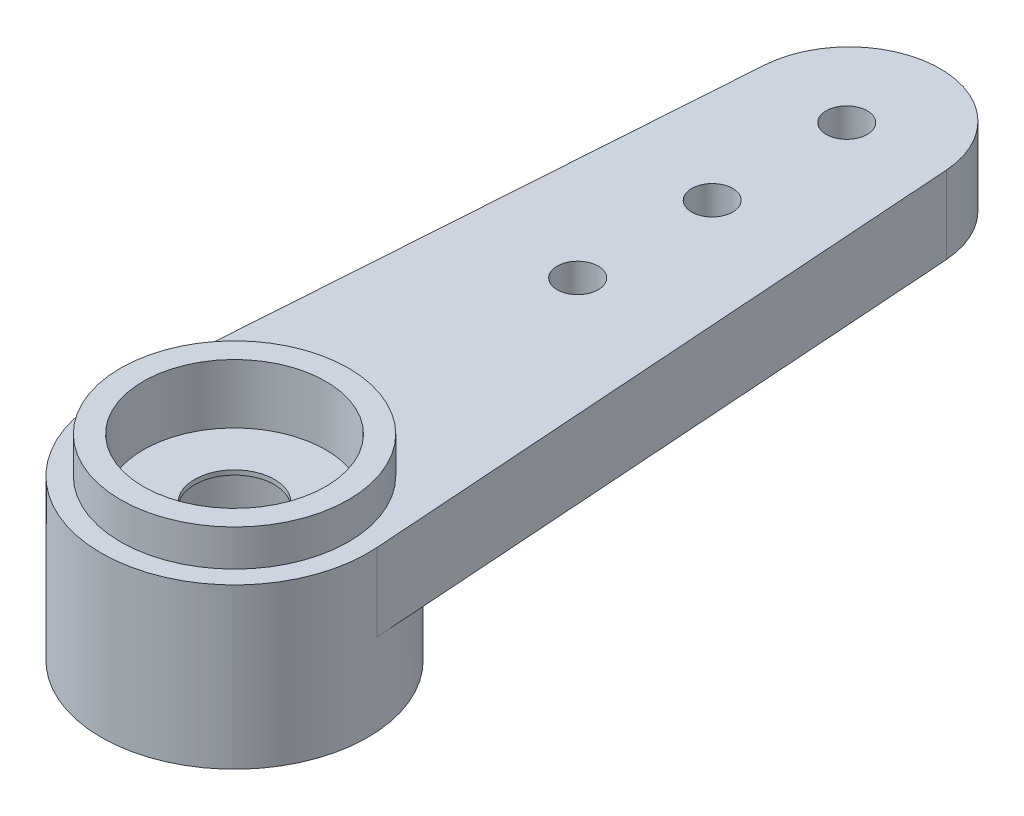
from build123d import *

# Parameters (mm, degrees)
SKETCH1_R           = 2.925
SKETCH1_R_2         = 1.925
BOSS_EXTRUDE1_DEPTH = 1.8
BOSS_EXTRUDE2_DEPTH = 1.7
SKETCH4_R           = 2.5
SKETCH4_R_2         = 2
BOSS_EXTRUDE3_DEPTH = 0.8
SKETCH5_R           = 0.45
CUT_EXTRUDE1_DEPTH  = 17.133234332
SKETCH6_R           = 0.875
CUT_EXTRUDE2_DEPTH  = 17.133234332
SKETCH7_R           = 1.925
CUT_EXTRUDE3_DEPTH  = 1.1
CUT_EXTRUDE4_START  = -0.5
SKETCH8_R           = 2
CUT_EXTRUDE4_DEPTH  = 0.5


with BuildPart() as part:
    # Sketch1 → Boss-Extrude1 (new body)
    with BuildSketch(Plane(origin=(0, 0, 0), x_dir=(1, 0, 0), z_dir=(0, 1, 0))):
        with Locations(Location((0, 0, 0), (0, 0, 270))):
            Circle(SKETCH1_R)
        with Locations(Location((0, 0, 0), (0, 0, 270))):
            Circle(SKETCH1_R_2, mode=Mode.SUBTRACT)
    extrude(amount=BOSS_EXTRUDE1_DEPTH)

    # Sketch3 → Boss-Extrude2 (add)
    with BuildSketch(Plane(origin=(0, 1.8, 0), x_dir=(1, 0, 0), z_dir=(0, 1, 0))):
        with BuildLine():
            Line((2.918100235, 0.200788497), (1.995282212, 13.61229128))
            ThreePointArc((1.995282212, 13.61229128), (0, 15.475), (-1.995282212, 13.61229128))
            Line((-1.995282212, 13.61229128), (-2.918100235, 0.200788497))
            ThreePointArc((-2.918100235, 0.200788497), (0, -2.925), (2.918100235, 0.200788497))
        make_face()
    extrude(amount=BOSS_EXTRUDE2_DEPTH)

    # Sketch4 → Boss-Extrude3 (add)
    with BuildSketch(Plane(origin=(0, 3.5, 0), x_dir=(1, 0, 0), z_dir=(0, 1, 0))):
        with Locations(Location((0, 0, 0), (0, 0, 270))):
            Circle(SKETCH4_R)
        with Locations(Location((0, 0, 0), (0, 0, 270))):
            Circle(SKETCH4_R_2, mode=Mode.SUBTRACT)
    extrude(amount=BOSS_EXTRUDE3_DEPTH)

    # Sketch5 → Cut-Extrude1 (cut, through all)
    with BuildSketch(Plane(origin=(0, 3.5, 0), x_dir=(1, 0, 0), z_dir=(0, 1, 0))):
        with Locations(Location((0, 13.425, 0), (0, 0, 270))):
            Circle(SKETCH5_R)
        with Locations(Location((0, 10.475, 0), (0, 0, 270))):
            Circle(SKETCH5_R)
        with Locations(Location((0, 7.525, 0), (0, 0, 270))):
            Circle(SKETCH5_R)
    extrude(amount=-CUT_EXTRUDE1_DEPTH, mode=Mode.SUBTRACT)

    # Sketch6 → Cut-Extrude2 (cut, through all)
    with BuildSketch(Plane(origin=(0, 3.5, 0), x_dir=(1, 0, 0), z_dir=(0, 1, 0))):
        with Locations(Location((0, 0, 0), (0, 0, 270))):
            Circle(SKETCH6_R)
    extrude(amount=-CUT_EXTRUDE2_DEPTH, mode=Mode.SUBTRACT)

    # Sketch7 → Cut-Extrude3 (cut)
    with BuildSketch(Plane.XZ.offset(-1.8)):
        with Locations(Location((0, 0, 0), (0, 0, 270))):
            Circle(SKETCH7_R)
    extrude(amount=-CUT_EXTRUDE3_DEPTH, mode=Mode.SUBTRACT)

    # Sketch8 → Cut-Extrude4 (cut)
    with BuildSketch(Plane(origin=(0, 3.5, 0), x_dir=(1, 0, 0), z_dir=(0, 1, 0)).offset(CUT_EXTRUDE4_START)):
        with Locations(Location((0, 0, 0), (0, 0, 270))):
            Circle(SKETCH8_R)
    extrude(amount=CUT_EXTRUDE4_DEPTH, mode=Mode.SUBTRACT)


solid = part.part
